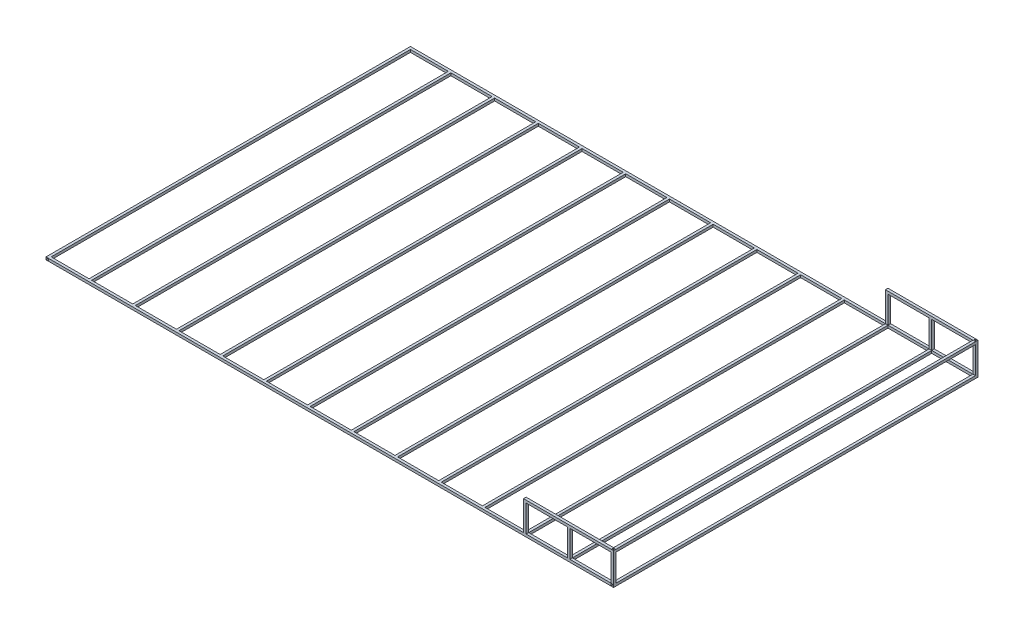
from build123d import *

# Parameters (mm, degrees)
SKETCH2_W           = 38.1
SKETCH2_H           = 38.1
BOSS_EXTRUDE1_DEPTH = 5400
SKETCH3_W           = 38.1
SKETCH3_H           = 38.1
BOSS_EXTRUDE2_DEPTH = 8333.79999988
LPATTERN1_COUNT     = 2
LPATTERN1_PITCH     = 8371.89999988
SKETCH4_W           = 38.1
SKETCH4_H           = 38.1
BOSS_EXTRUDE3_DEPTH = 5323.8
SKETCH5_W           = 38.1
SKETCH5_H           = 38.1
BOSS_EXTRUDE4_DEPTH = 435.864
SKETCH6_W           = 38.1
SKETCH6_H           = 38.1
BOSS_EXTRUDE5_DEPTH = 5323.8
SKETCH5_3_W         = 38.1
SKETCH5_3_H         = 38.1
BOSS_EXTRUDE6_DEPTH = 397.764
SKETCH7_W           = 38.1
SKETCH7_H           = 38.1
BOSS_EXTRUDE7_DEPTH = 1295.4


with BuildPart() as part:
    # Sketch2 → Boss-Extrude1 (new body)
    with BuildSketch(Plane.XY):
        with Locations((-19.05, 19.05)):
            Rectangle(SKETCH2_W, SKETCH2_H)
        with BuildLine():
            Line((-35.4, 5.24), (-35.4, 32.86))
            ThreePointArc((-35.4, 32.86), (-34.656051224, 34.656051224), (-32.86, 35.4))
            Line((-32.86, 35.4), (-5.24, 35.4))
            ThreePointArc((-5.24, 35.4), (-3.443948776, 34.656051224), (-2.7, 32.86))
            Line((-2.7, 32.86), (-2.7, 5.24))
            ThreePointArc((-2.7, 5.24), (-3.443948776, 3.443948776), (-5.24, 2.7))
            Line((-5.24, 2.7), (-32.86, 2.7))
            ThreePointArc((-32.86, 2.7), (-34.656051224, 3.443948776), (-35.4, 5.24))
        make_face(mode=Mode.SUBTRACT)
    boss_extrude1 = extrude(amount=-BOSS_EXTRUDE1_DEPTH)

    # Sketch3 → Boss-Extrude2 (add)
    # profile 1 of 2: a face of its own
    with BuildSketch(Plane.ZY.offset(38.1)):
        with Locations((-5380.95, 19.05)):
            Rectangle(SKETCH3_W, SKETCH3_H)
        with BuildLine():
            Line((-5364.6, 32.86), (-5364.6, 5.24))
            ThreePointArc((-5364.6, 5.24), (-5365.343948776, 3.443948776), (-5367.14, 2.7))
            Line((-5367.14, 2.7), (-5394.76, 2.7))
            ThreePointArc((-5394.76, 2.7), (-5396.556051224, 3.443948776), (-5397.3, 5.24))
            Line((-5397.3, 5.24), (-5397.3, 32.86))
            ThreePointArc((-5397.3, 32.86), (-5396.556051224, 34.656051224), (-5394.76, 35.4))
            Line((-5394.76, 35.4), (-5367.14, 35.4))
            ThreePointArc((-5367.14, 35.4), (-5365.343948776, 34.656051224), (-5364.6, 32.86))
        make_face(mode=Mode.SUBTRACT)
    # profile 2 of 2: a face of its own
    with BuildSketch(Plane.ZY.offset(38.1)):
        with Locations((-19.05, 19.05)):
            Rectangle(SKETCH3_W, SKETCH3_H)
        with BuildLine():
            Line((-2.7, 32.86), (-2.7, 5.24))
            ThreePointArc((-2.7, 5.24), (-3.443948776, 3.443948776), (-5.24, 2.7))
            Line((-5.24, 2.7), (-32.86, 2.7))
            ThreePointArc((-32.86, 2.7), (-34.656051224, 3.443948776), (-35.4, 5.24))
            Line((-35.4, 5.24), (-35.4, 32.86))
            ThreePointArc((-35.4, 32.86), (-34.656051224, 34.656051224), (-32.86, 35.4))
            Line((-32.86, 35.4), (-5.24, 35.4))
            ThreePointArc((-5.24, 35.4), (-3.443948776, 34.656051224), (-2.7, 32.86))
        make_face(mode=Mode.SUBTRACT)
    extrude(amount=BOSS_EXTRUDE2_DEPTH)

    # LPattern1: Boss-Extrude1 ×2
    with Locations(*[(-i * LPATTERN1_PITCH, 0, 0) for i in range(1, LPATTERN1_COUNT)]):
        add(boss_extrude1)

    # Sketch4 → Boss-Extrude3 (add)
    with BuildSketch(Plane.XY.offset(-5361.9)):
        with Locations((-666.75, 19.05)):
            Rectangle(SKETCH4_W, SKETCH4_H)
        with Locations((-1314.45, 19.05)):
            Rectangle(SKETCH4_W, SKETCH4_H)
        with Locations((-1962.15, 19.05)):
            Rectangle(SKETCH4_W, SKETCH4_H)
        with Locations((-2609.85, 19.05)):
            Rectangle(SKETCH4_W, SKETCH4_H)
        with Locations((-3257.55, 19.05)):
            Rectangle(SKETCH4_W, SKETCH4_H)
        with Locations((-3905.25, 19.05)):
            Rectangle(SKETCH4_W, SKETCH4_H)
        with Locations((-4552.95, 19.05)):
            Rectangle(SKETCH4_W, SKETCH4_H)
        with Locations((-5200.65, 19.05)):
            Rectangle(SKETCH4_W, SKETCH4_H)
        with Locations((-5848.35, 19.05)):
            Rectangle(SKETCH4_W, SKETCH4_H)
        with Locations((-6496.05, 19.05)):
            Rectangle(SKETCH4_W, SKETCH4_H)
        with Locations((-7143.75, 19.05)):
            Rectangle(SKETCH4_W, SKETCH4_H)
        with Locations((-7791.45, 19.05)):
            Rectangle(SKETCH4_W, SKETCH4_H)
    extrude(amount=BOSS_EXTRUDE3_DEPTH)

    # Sketch5 → Boss-Extrude4 (add)
    # profile 1 of 2: a face of its own
    with BuildSketch(Plane(origin=(0, 38.1, 0), x_dir=(1, 0, 0), z_dir=(0, 1, 0))):
        with Locations((-19.05, 19.05)):
            Rectangle(SKETCH5_W, SKETCH5_H)
        with BuildLine():
            Line((-32.86, 35.4), (-5.24, 35.4))
            ThreePointArc((-5.24, 35.4), (-3.443948776, 34.656051224), (-2.7, 32.86))
            Line((-2.7, 32.86), (-2.7, 5.24))
            ThreePointArc((-2.7, 5.24), (-3.443948776, 3.443948776), (-5.24, 2.7))
            Line((-5.24, 2.7), (-32.86, 2.7))
            ThreePointArc((-32.86, 2.7), (-34.656051224, 3.443948776), (-35.4, 5.24))
            Line((-35.4, 5.24), (-35.4, 32.86))
            ThreePointArc((-35.4, 32.86), (-34.656051224, 34.656051224), (-32.86, 35.4))
        make_face(mode=Mode.SUBTRACT)
    # profile 2 of 2: a face of its own
    with BuildSketch(Plane(origin=(0, 38.1, 0), x_dir=(1, 0, 0), z_dir=(0, 1, 0))):
        with Locations((-19.05, 5380.95)):
            Rectangle(SKETCH5_W, SKETCH5_H)
        with BuildLine():
            Line((-32.86, 5364.6), (-5.24, 5364.6))
            ThreePointArc((-5.24, 5364.6), (-3.443948776, 5365.343948776), (-2.7, 5367.14))
            Line((-2.7, 5367.14), (-2.7, 5394.76))
            ThreePointArc((-2.7, 5394.76), (-3.443948776, 5396.556051224), (-5.24, 5397.3))
            Line((-5.24, 5397.3), (-32.86, 5397.3))
            ThreePointArc((-32.86, 5397.3), (-34.656051224, 5396.556051224), (-35.4, 5394.76))
            Line((-35.4, 5394.76), (-35.4, 5367.14))
            ThreePointArc((-35.4, 5367.14), (-34.656051224, 5365.343948776), (-32.86, 5364.6))
        make_face(mode=Mode.SUBTRACT)
    extrude(amount=BOSS_EXTRUDE4_DEPTH)

    # Sketch6 → Boss-Extrude5 (add)
    with BuildSketch(Plane.XY.offset(-5361.9)):
        with Locations((-19.05, 454.914)):
            Rectangle(SKETCH6_W, SKETCH6_H)
        with BuildLine():
            Line((-5.24, 438.564), (-32.86, 438.564))
            ThreePointArc((-32.86, 438.564), (-34.656051224, 439.307948776), (-35.4, 441.104))
            Line((-35.4, 441.104), (-35.4, 468.724))
            ThreePointArc((-35.4, 468.724), (-34.656051224, 470.520051224), (-32.86, 471.264))
            Line((-32.86, 471.264), (-5.24, 471.264))
            ThreePointArc((-5.24, 471.264), (-3.443948776, 470.520051224), (-2.7, 468.724))
            Line((-2.7, 468.724), (-2.7, 441.104))
            ThreePointArc((-2.7, 441.104), (-3.443948776, 439.307948776), (-5.24, 438.564))
        make_face(mode=Mode.SUBTRACT)
    extrude(amount=BOSS_EXTRUDE5_DEPTH)

    # Sketch5<3> → Boss-Extrude6 (add)
    # profile 1 of 4: a face of its own
    with BuildSketch(Plane(origin=(0, 38.1, 0), x_dir=(1, 0, 0), z_dir=(0, 1, 0))):
        with Locations((-666.75, 5380.95)):
            Rectangle(SKETCH5_3_W, SKETCH5_3_H)
        with BuildLine():
            ThreePointArc((-680.56, 5397.3), (-682.356051224, 5396.556051224), (-683.1, 5394.76))
            Line((-683.1, 5394.76), (-683.1, 5367.14))
            ThreePointArc((-683.1, 5367.14), (-682.356051224, 5365.343948776), (-680.56, 5364.6))
            Line((-680.56, 5364.6), (-652.94, 5364.6))
            ThreePointArc((-652.94, 5364.6), (-651.143948776, 5365.343948776), (-650.4, 5367.14))
            Line((-650.4, 5367.14), (-650.4, 5394.76))
            ThreePointArc((-650.4, 5394.76), (-651.143948776, 5396.556051224), (-652.94, 5397.3))
            Line((-652.94, 5397.3), (-680.56, 5397.3))
        make_face(mode=Mode.SUBTRACT)
    # profile 2 of 4: a face of its own
    with BuildSketch(Plane(origin=(0, 38.1, 0), x_dir=(1, 0, 0), z_dir=(0, 1, 0))):
        with Locations((-666.75, 19.05)):
            Rectangle(SKETCH5_3_W, SKETCH5_3_H)
        with BuildLine():
            Line((-680.56, 35.4), (-652.94, 35.4))
            ThreePointArc((-652.94, 35.4), (-651.143948776, 34.656051224), (-650.4, 32.86))
            Line((-650.4, 32.86), (-650.4, 5.24))
            ThreePointArc((-650.4, 5.24), (-651.143948776, 3.443948776), (-652.94, 2.7))
            Line((-652.94, 2.7), (-680.56, 2.7))
            ThreePointArc((-680.56, 2.7), (-682.356051224, 3.443948776), (-683.1, 5.24))
            Line((-683.1, 5.24), (-683.1, 32.86))
            ThreePointArc((-683.1, 32.86), (-682.356051224, 34.656051224), (-680.56, 35.4))
        make_face(mode=Mode.SUBTRACT)
    # profile 3 of 4: a face of its own
    with BuildSketch(Plane(origin=(0, 38.1, 0), x_dir=(1, 0, 0), z_dir=(0, 1, 0))):
        with Locations((-1314.45, 19.05)):
            Rectangle(SKETCH5_3_W, SKETCH5_3_H)
        with BuildLine():
            Line((-1328.26, 2.7), (-1300.64, 2.7))
            ThreePointArc((-1300.64, 2.7), (-1298.843948776, 3.443948776), (-1298.1, 5.24))
            Line((-1298.1, 5.24), (-1298.1, 32.86))
            ThreePointArc((-1298.1, 32.86), (-1298.843948776, 34.656051224), (-1300.64, 35.4))
            Line((-1300.64, 35.4), (-1328.26, 35.4))
            ThreePointArc((-1328.26, 35.4), (-1330.056051224, 34.656051224), (-1330.8, 32.86))
            Line((-1330.8, 32.86), (-1330.8, 5.24))
            ThreePointArc((-1330.8, 5.24), (-1330.056051224, 3.443948776), (-1328.26, 2.7))
        make_face(mode=Mode.SUBTRACT)
    # profile 4 of 4: a face of its own
    with BuildSketch(Plane(origin=(0, 38.1, 0), x_dir=(1, 0, 0), z_dir=(0, 1, 0))):
        with Locations((-1314.45, 5380.95)):
            Rectangle(SKETCH5_3_W, SKETCH5_3_H)
        with BuildLine():
            Line((-1328.26, 5364.6), (-1300.64, 5364.6))
            ThreePointArc((-1300.64, 5364.6), (-1298.843948776, 5365.343948776), (-1298.1, 5367.14))
            Line((-1298.1, 5367.14), (-1298.1, 5394.76))
            ThreePointArc((-1298.1, 5394.76), (-1298.843948776, 5396.556051224), (-1300.64, 5397.3))
            Line((-1300.64, 5397.3), (-1328.26, 5397.3))
            ThreePointArc((-1328.26, 5397.3), (-1330.056051224, 5396.556051224), (-1330.8, 5394.76))
            Line((-1330.8, 5394.76), (-1330.8, 5367.14))
            ThreePointArc((-1330.8, 5367.14), (-1330.056051224, 5365.343948776), (-1328.26, 5364.6))
        make_face(mode=Mode.SUBTRACT)
    extrude(amount=BOSS_EXTRUDE6_DEPTH)

    # Sketch7 → Boss-Extrude7 (add)
    # profile 1 of 2: a face of its own
    with BuildSketch(Plane.ZY.offset(38.1)):
        with Locations((-19.05, 454.914)):
            Rectangle(SKETCH7_W, SKETCH7_H)
        with BuildLine():
            Line((-35.4, 441.104), (-35.4, 468.724))
            ThreePointArc((-35.4, 468.724), (-34.656051224, 470.520051224), (-32.86, 471.264))
            Line((-32.86, 471.264), (-5.24, 471.264))
            ThreePointArc((-5.24, 471.264), (-3.443948776, 470.520051224), (-2.7, 468.724))
            Line((-2.7, 468.724), (-2.7, 441.104))
            ThreePointArc((-2.7, 441.104), (-3.443948776, 439.307948776), (-5.24, 438.564))
            Line((-5.24, 438.564), (-32.86, 438.564))
            ThreePointArc((-32.86, 438.564), (-34.656051224, 439.307948776), (-35.4, 441.104))
        make_face(mode=Mode.SUBTRACT)
    # profile 2 of 2: a face of its own
    with BuildSketch(Plane.ZY.offset(38.1)):
        with Locations((-5380.95, 454.914)):
            Rectangle(SKETCH7_W, SKETCH7_H)
        with BuildLine():
            Line((-5367.14, 438.564), (-5394.76, 438.564))
            ThreePointArc((-5394.76, 438.564), (-5396.556051224, 439.307948776), (-5397.3, 441.104))
            Line((-5397.3, 441.104), (-5397.3, 468.724))
            ThreePointArc((-5397.3, 468.724), (-5396.556051224, 470.520051224), (-5394.76, 471.264))
            Line((-5394.76, 471.264), (-5367.14, 471.264))
            ThreePointArc((-5367.14, 471.264), (-5365.343948776, 470.520051224), (-5364.6, 468.724))
            Line((-5364.6, 468.724), (-5364.6, 441.104))
            ThreePointArc((-5364.6, 441.104), (-5365.343948776, 439.307948776), (-5367.14, 438.564))
        make_face(mode=Mode.SUBTRACT)
    extrude(amount=BOSS_EXTRUDE7_DEPTH)


solid = part.part
